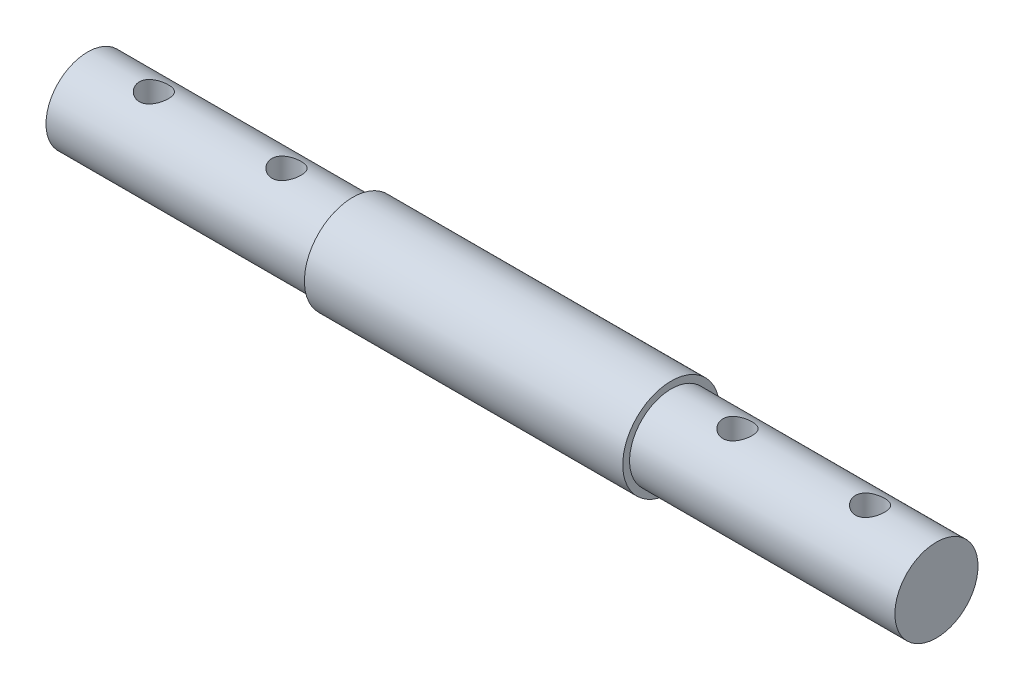
from build123d import *

# Parameters (mm, degrees)
SKETCH1_R               = 36.5
BOSS_EXTRUDE1_DEPTH     = 240
SKETCH2_R               = 31.34
BOSS_EXTRUDE2_DEPTH     = 200
BOSS_EXTRUDE3_START     = 200
SKETCH3_R               = 31.34
BOSS_EXTRUDE3_DEPTH     = 200
CUT_EXTRUDE1_DEPTH      = 444.017494011
CUT_EXTRUDE1_DEPTH_BACK = 444.017494011
SKETCH4_R               = 11


with BuildPart() as part:
    # Sketch1 → Boss-Extrude1 (new body)
    with BuildSketch(Plane(origin=(0, 0, 0), x_dir=(0, 0, -1), z_dir=(1, 0, 0))):
        Circle(SKETCH1_R)
    extrude(amount=BOSS_EXTRUDE1_DEPTH)

    # Sketch2 → Boss-Extrude2 (add)
    with BuildSketch(Plane(origin=(240, 0, 0), x_dir=(0, 0, -1), z_dir=(1, 0, 0))):
        Circle(SKETCH2_R)
    extrude(amount=BOSS_EXTRUDE2_DEPTH)

    # Sketch3 → Boss-Extrude3 (add)
    with BuildSketch(Plane.ZY.offset(BOSS_EXTRUDE3_START)):
        with Locations(Location((0, 0, 0), (0, 0, 180))):
            Circle(SKETCH3_R)
    extrude(amount=-BOSS_EXTRUDE3_DEPTH)

    # Sketch4 → Cut-Extrude1 (cut, two sides: drawn at the far end of the back side and taken through both)
    with BuildSketch(Plane(origin=(0, 0, 0), x_dir=(1, 0, 0), z_dir=(0, 1, 0)).offset(-CUT_EXTRUDE1_DEPTH_BACK)):
        with Locations(Location((-50, 0, 0), (0, 0, 270))):
            Circle(SKETCH4_R)
        with Locations(Location((-150, 0, 0), (0, 0, 270))):
            Circle(SKETCH4_R)
        with Locations(Location((290, 0, 0), (0, 0, 270))):
            Circle(SKETCH4_R)
        with Locations(Location((390, 0, 0), (0, 0, 270))):
            Circle(SKETCH4_R)
    extrude(amount=CUT_EXTRUDE1_DEPTH + CUT_EXTRUDE1_DEPTH_BACK, mode=Mode.SUBTRACT)


solid = part.part
